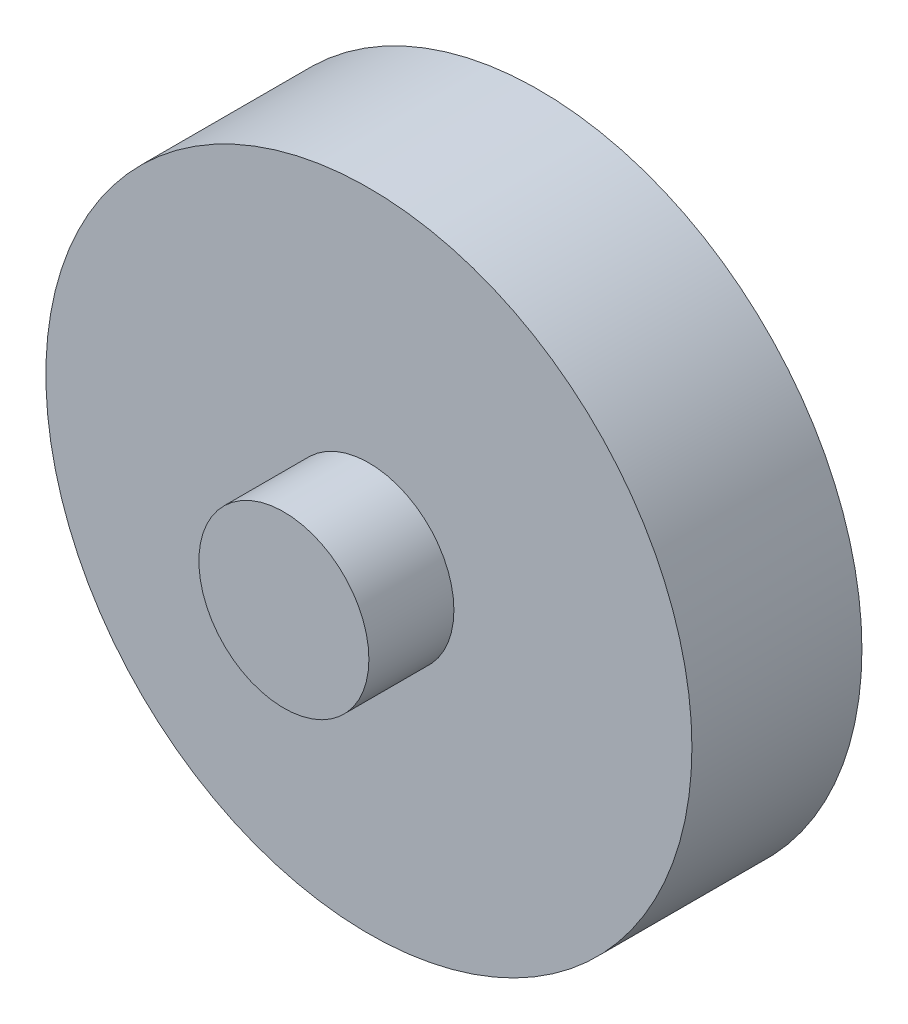
from build123d import *

# Parameters (mm, degrees)
SKETCH1_R           = 48.26
BOSS_EXTRUDE1_DEPTH = 25.4
SKETCH2_R           = 12.7
BOSS_EXTRUDE2_DEPTH = 12.7
BOSS_EXTRUDE3_START = 12.7
SKETCH3_R           = 12.7
BOSS_EXTRUDE3_DEPTH = 12.7


with BuildPart() as part:
    # Sketch1 → Boss-Extrude1 (new body)
    with BuildSketch(Plane.XY):
        Circle(SKETCH1_R)
    extrude(amount=BOSS_EXTRUDE1_DEPTH)

    # Sketch2 → Boss-Extrude2 (add)
    with BuildSketch(Plane.XY.offset(25.4)):
        Circle(SKETCH2_R)
    extrude(amount=BOSS_EXTRUDE2_DEPTH)

    # Sketch3 → Boss-Extrude3 (add)
    with BuildSketch(Plane(origin=(0, 0, 0), x_dir=(-1, 0, 0), z_dir=(0, 0, -1)).offset(BOSS_EXTRUDE3_START)):
        with Locations(Location((0, 0, 0), (0, 0, 180))):
            Circle(SKETCH3_R)
    extrude(amount=-BOSS_EXTRUDE3_DEPTH)


solid = part.part
